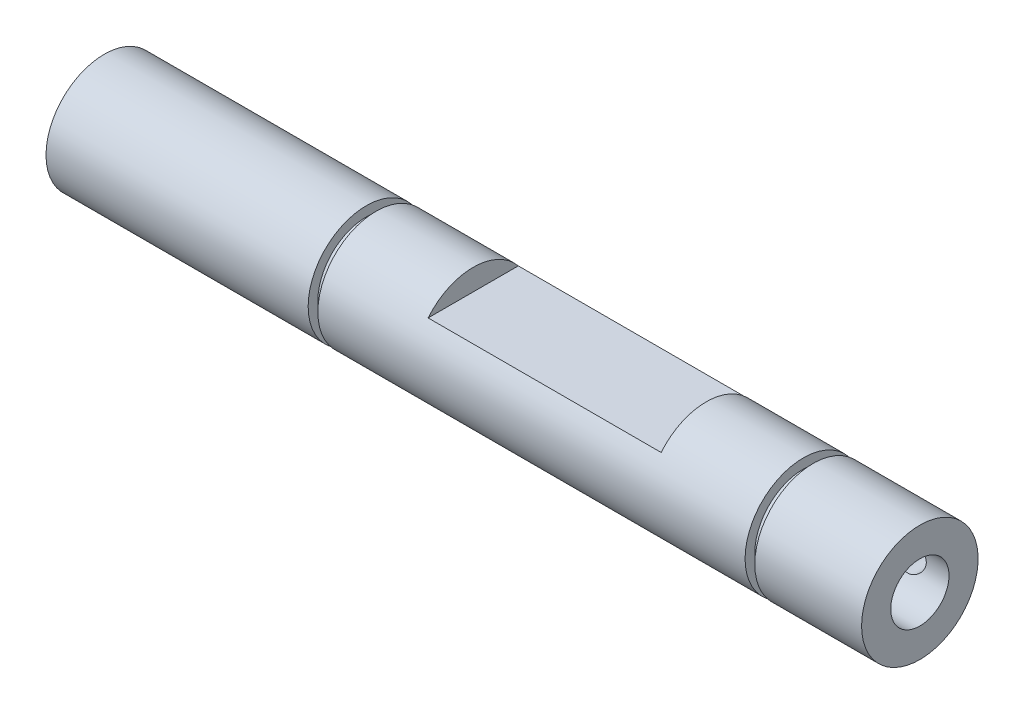
from build123d import *

# Parameters (mm, degrees)
SKETCH2_R          = 3
CUT_EXTRUDE1_DEPTH = 10
SKETCH3_R          = 1.5
CUT_EXTRUDE2_DEPTH = 10
CUT_EXTRUDE3_DEPTH = 2.2
SKETCH6_W          = 24
SKETCH6_H          = 3.713708499
CUT_EXTRUDE4_DEPTH = 8


with BuildPart() as part:
    # Sketch1 → Revolve1 (revolve)
    with BuildSketch(Plane.XY, mode=Mode.PRIVATE) as revolve1_sk:
        Polygon((-45.933362566, 0), (38.066637434, 0), (38.066637434, 6), (27.066637434, 6), (27.066637434, 5), (26.066637434, 5), (26.066637434, 6), (-17.933362566, 6), (-17.933362566, 5), (-18.933362566, 5), (-18.933362566, 6), (-45.933362566, 6), align=None)
    revolve(revolve1_sk.sketch.rotate(Axis((-45.933362566, 0, 0), (1, 0, 0)), 90), axis=Axis((-45.933362566, 0, 0), (1, 0, 0)))

    # Sketch2 → Cut-Extrude1 (cut)
    with BuildSketch(Plane(origin=(38.066637434, 0, 0), x_dir=(0, 0, -1), z_dir=(1, 0, 0))):
        Circle(SKETCH2_R)
    extrude(amount=-CUT_EXTRUDE1_DEPTH, mode=Mode.SUBTRACT)

    # Sketch3 → Cut-Extrude2 (cut)
    with BuildSketch(Plane.XY):
        with Locations((34.231149576, 0)):
            Circle(SKETCH3_R)
    extrude(amount=-CUT_EXTRUDE2_DEPTH, mode=Mode.SUBTRACT)

    # Sketch5 → Cut-Extrude3 (cut)
    with BuildSketch(Plane(origin=(0, 6, 0), x_dir=(1, 0, 0), z_dir=(0, 1, 0))):
        with BuildLine():
            Line((-5.933362566, 2), (14.066637434, 2))
            ThreePointArc((14.066637434, 2), (16.066637434, 0), (14.066637434, -2))
            Line((14.066637434, -2), (-5.933362566, -2))
            ThreePointArc((-5.933362566, -2), (-7.933362566, 0), (-5.933362566, 2))
        make_face()
    extrude(amount=-CUT_EXTRUDE3_DEPTH, mode=Mode.SUBTRACT)

    # Sketch6 → Cut-Extrude4 (cut, symmetric)
    with BuildSketch(Plane.XY):
        with Locations((4.066637434, 5.65685425)):
            Rectangle(SKETCH6_W, SKETCH6_H)
    extrude(amount=CUT_EXTRUDE4_DEPTH, both=True, mode=Mode.SUBTRACT)


solid = part.part
